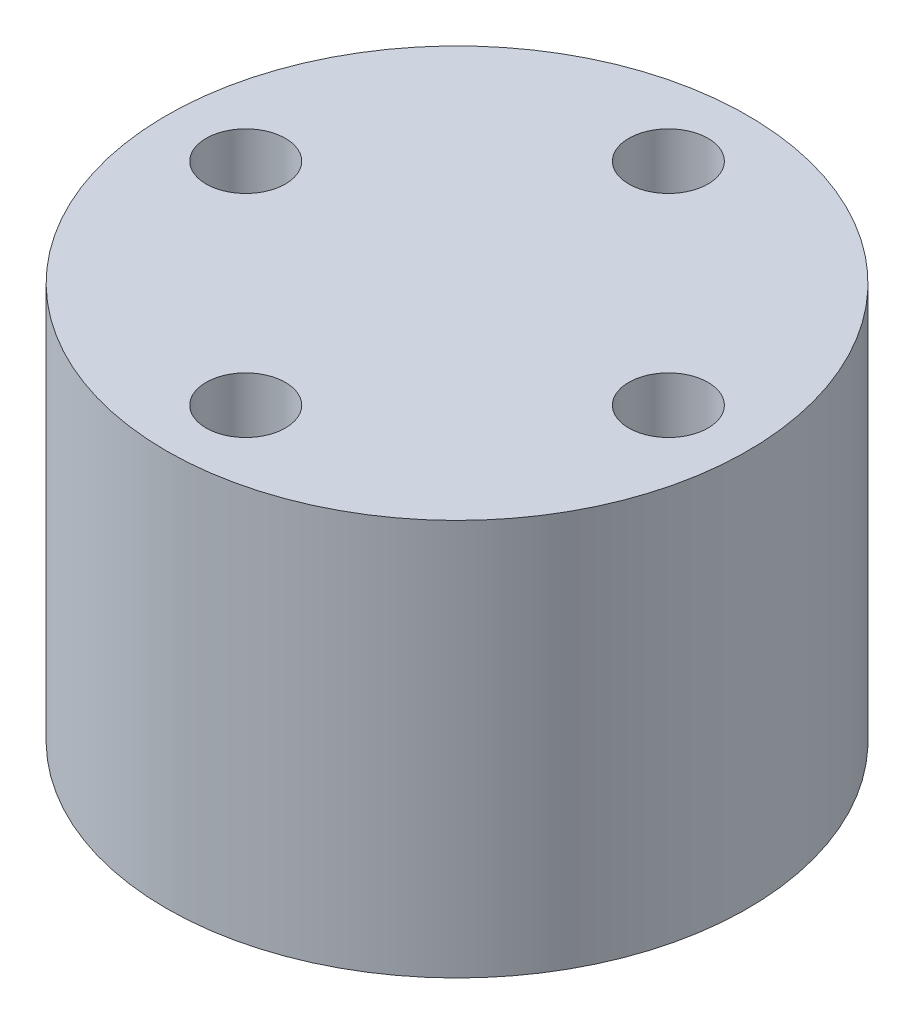
from build123d import *

# Parameters (mm, degrees)
SKETCH_1_R      = 11
SKETCH_1_R_2    = 1.5
EXTRUDE_1_DEPTH = 15


with BuildPart() as part:
    # 草图1 → 凸台-拉伸1 (new body)
    with BuildSketch(Plane(origin=(0, 0, 0), x_dir=(1, 0, 0), z_dir=(0, 1, 0))):
        with Locations(Location((0, 0, 0), (0, 0, 270))):
            Circle(SKETCH_1_R)
        with Locations(Location((0, 8, 0), (0, 0, 270))):
            Circle(SKETCH_1_R_2, mode=Mode.SUBTRACT)
        with Locations(Location((8, 0, 0), (0, 0, 270))):
            Circle(SKETCH_1_R_2, mode=Mode.SUBTRACT)
        with Locations(Location((0, -8, 0), (0, 0, 270))):
            Circle(SKETCH_1_R_2, mode=Mode.SUBTRACT)
        with Locations(Location((-8, 0, 0), (0, 0, 270))):
            Circle(SKETCH_1_R_2, mode=Mode.SUBTRACT)
    extrude(amount=EXTRUDE_1_DEPTH)


solid = part.part
